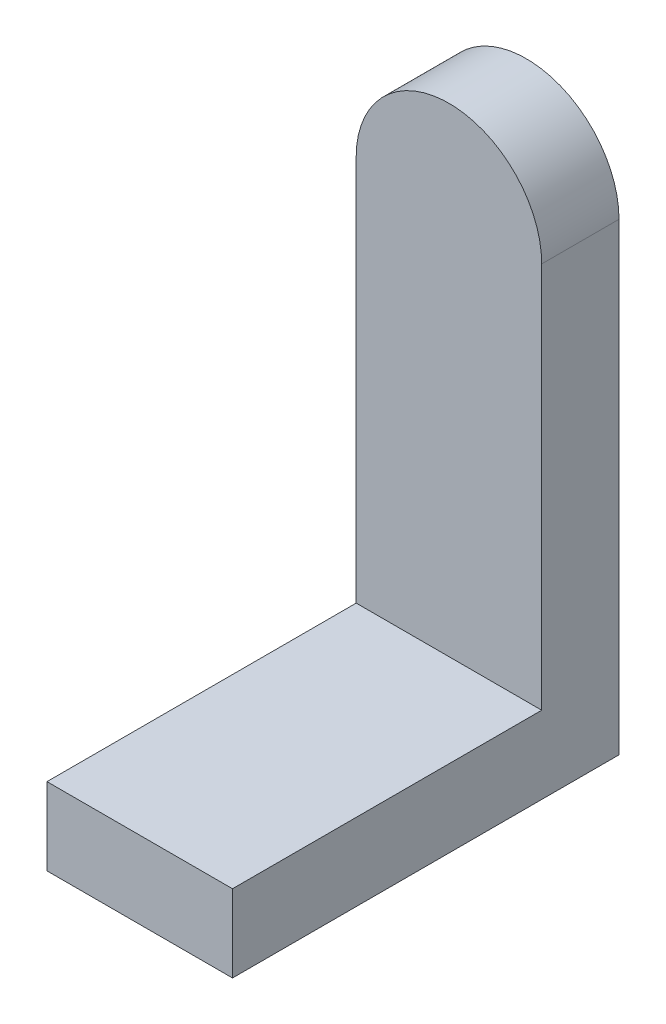
from build123d import *

# Parameters (mm, degrees)
BOSS_EXTRUDE1_DEPTH = 5
SKETCH2_W           = 20
SKETCH2_H           = 5
BOSS_EXTRUDE2_DEPTH = 12


with BuildPart() as part:
    # Sketch1 → Boss-Extrude1 (new body)
    with BuildSketch(Plane.XY):
        with BuildLine():
            ThreePointArc((6, 15), (0, 21), (-6, 15))
            Line((-6, 15), (6, 15))
        make_face()
        with BuildLine():
            Line((6, 15), (-6, 15))
            ThreePointArc((-6, 15), (0, 9), (6, 15))
        make_face()
        with BuildLine():
            ThreePointArc((6, 15), (0, 9), (-6, 15))
            Line((-6, 15), (-6, -15))
            Line((-6, -15), (6, -15))
            Line((6, -15), (6, 15))
        make_face()
    extrude(amount=BOSS_EXTRUDE1_DEPTH)

    # Sketch2 → Boss-Extrude2 (add)
    with BuildSketch(Plane(origin=(6, 0, 0), x_dir=(0, 0, -1), z_dir=(1, 0, 0))):
        with Locations((-15, -12.5)):
            Rectangle(SKETCH2_W, SKETCH2_H)
    extrude(amount=-BOSS_EXTRUDE2_DEPTH)


solid = part.part
